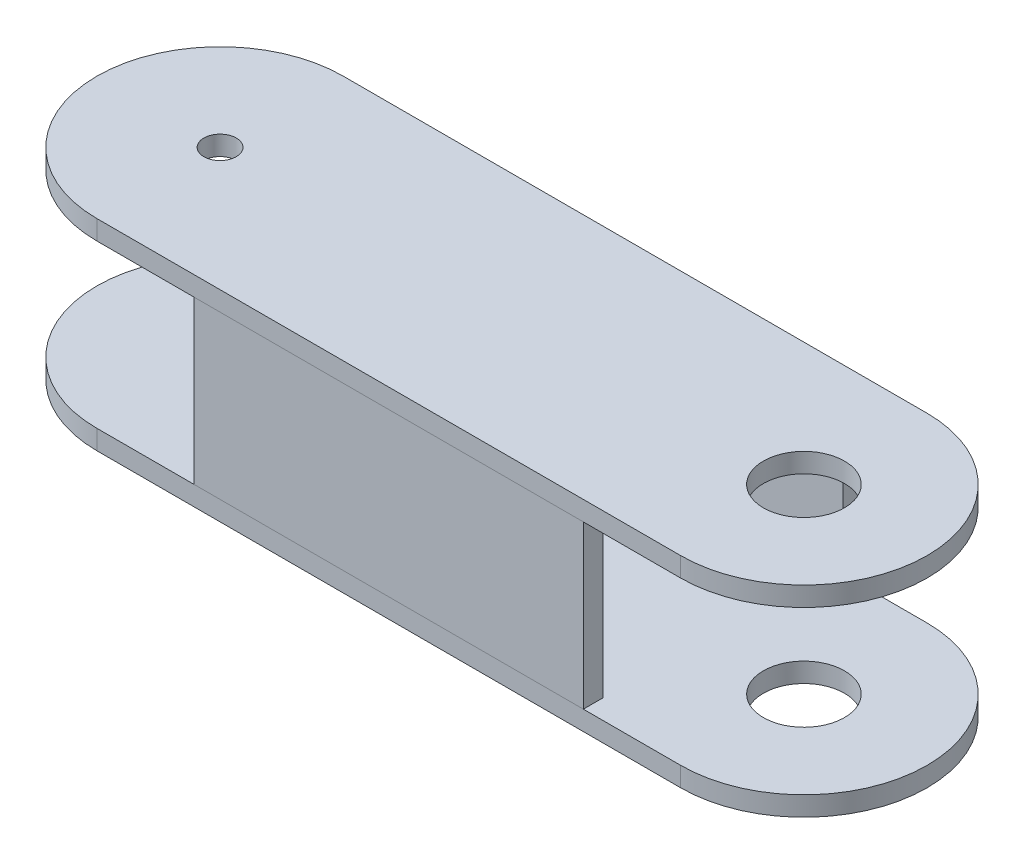
from build123d import *

# Parameters (mm, degrees)
SKETCH2_R               = 12.5
SKETCH2_R_2             = 5
BOSS_EXTRUDE1_DEPTH     = 31
CUT_EXTRUDE1_DEPTH      = 138.072973266
CUT_EXTRUDE1_DEPTH_BACK = 138.072973266
SKETCH3_W               = 76
SKETCH3_H               = 50
BOSS_EXTRUDE2_REACH     = 146.79
SKETCH4_W               = 140
SKETCH4_H               = 6
SKETCH4_W_2             = 120


with BuildPart() as part:
    # Sketch2 → Boss-Extrude1 (new, symmetric)
    with BuildSketch(Plane(origin=(0, 0, 0), x_dir=(1, 0, 0), z_dir=(0, 1, 0))):
        with BuildLine():
            Line((-90, 38), (90, 38))
            ThreePointArc((90, 38), (128, 0), (90, -38))
            Line((90, -38), (-90, -38))
            ThreePointArc((-90, -38), (-128, 0), (-90, 38))
        make_face()
        with Locations(Location((90, 0, 0), (0, 0, 270))):
            Circle(SKETCH2_R, mode=Mode.SUBTRACT)
        with Locations(Location((-90, 0, 0), (0, 0, 270))):
            Circle(SKETCH2_R_2, mode=Mode.SUBTRACT)
    extrude(amount=BOSS_EXTRUDE1_DEPTH, both=True)

    # Sketch3 → Cut-Extrude1 (cut, two sides: drawn at the far end of the back side and taken through both)
    with BuildSketch(Plane(origin=(0, 0, 0), x_dir=(0, 0, -1), z_dir=(1, 0, 0)).offset(-CUT_EXTRUDE1_DEPTH_BACK)):
        Rectangle(SKETCH3_W, SKETCH3_H)
    extrude(amount=CUT_EXTRUDE1_DEPTH + CUT_EXTRUDE1_DEPTH_BACK, mode=Mode.SUBTRACT)


with BuildPart() as cut_extrude1_piece_1:
    # of the separate pieces the step leaves, piece 1, a body of its own (cut_extrude1_pieces)
    add(part.part.solids().sort_by_distance((-90, 25, -38))[0])


with BuildPart() as cut_extrude1_piece_2:
    # of the separate pieces the step leaves, piece 2, a body of its own (cut_extrude1_pieces)
    add(part.part.solids().sort_by_distance((-90, -31, -38))[0])


with BuildPart() as body_3:

    # Sketch4 → Boss-Extrude2 (new, up to next)
    with BuildSketch(Plane(origin=(0, -25, 0), x_dir=(1, 0, 0), z_dir=(0, 1, 0)), mode=Mode.PRIVATE) as boss_extrude2_sk1:
        with Locations((0, 35)):
            Rectangle(SKETCH4_W, SKETCH4_H)
    boss_extrude2_tool1 = extrude(boss_extrude2_sk1.sketch, amount=BOSS_EXTRUDE2_REACH, mode=Mode.PRIVATE) - cut_extrude1_piece_1.part
    # Sketch4 → Boss-Extrude2 (new, up to next)
    with BuildSketch(Plane(origin=(0, -25, 0), x_dir=(1, 0, 0), z_dir=(0, 1, 0)), mode=Mode.PRIVATE) as boss_extrude2_sk2:
        with Locations((0, -35)):
            Rectangle(SKETCH4_W_2, SKETCH4_H)
    boss_extrude2_tool2 = extrude(boss_extrude2_sk2.sketch, amount=BOSS_EXTRUDE2_REACH, mode=Mode.PRIVATE) - cut_extrude1_piece_1.part
    add(boss_extrude2_tool1.solids().sort_by_distance((0, -25, -35))[0])
    add(boss_extrude2_tool2.solids().sort_by_distance((0, -25, 35))[0])


solid = Compound([cut_extrude1_piece_1.part, cut_extrude1_piece_2.part, body_3.part])
